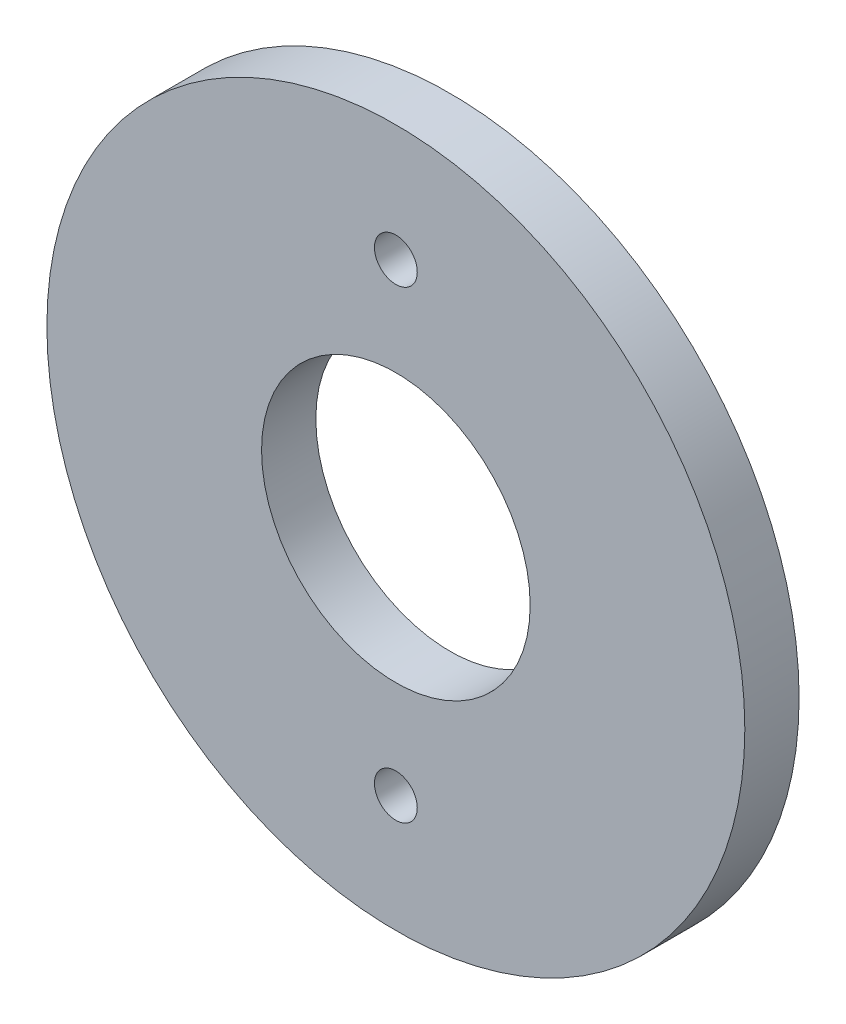
from build123d import *

# Parameters (mm, degrees)
SKETCH1_R           = 28.575
SKETCH1_R_2         = 10.9982
SKETCH1_R_3         = 1.7526
BOSS_EXTRUDE1_DEPTH = 4.445


with BuildPart() as part:
    # Sketch1 → Boss-Extrude1 (new body)
    with BuildSketch(Plane.XY):
        Circle(SKETCH1_R)
        Circle(SKETCH1_R_2, mode=Mode.SUBTRACT)
        with Locations((0, 18.9992)):
            Circle(SKETCH1_R_3, mode=Mode.SUBTRACT)
        with Locations((0, -18.9992)):
            Circle(SKETCH1_R_3, mode=Mode.SUBTRACT)
    extrude(amount=BOSS_EXTRUDE1_DEPTH)


solid = part.part
